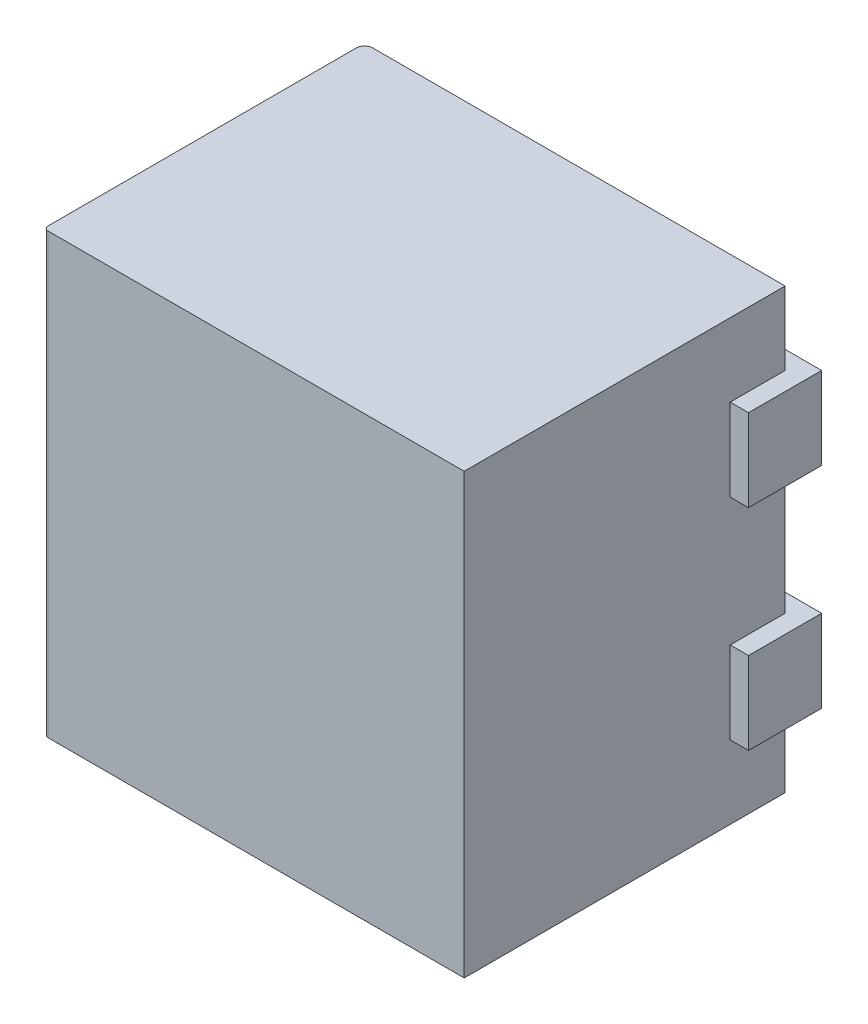
from build123d import *

# Parameters (mm, degrees)
SKETCH1_W           = 4.6
SKETCH1_H           = 4.8
BOSS_EXTRUDE1_DEPTH = 3.51
FILLET1_R           = 0.09
SKETCH2_W           = 1.14
SKETCH2_H           = 1.3
SKETCH2_W_2         = 1
SKETCH2_H_2         = 0.9
BOSS_EXTRUDE2_DEPTH = 0.8
FILLET2_R           = 0.15
SKETCH3_R           = 0.75
CUT_EXTRUDE1_DEPTH  = 0.5
FILLET3_R           = 0.05
SKETCH4_R           = 0.725
CUT_EXTRUDE2_DEPTH  = 0.01


with BuildPart() as part:
    # Sketch1 → Boss-Extrude1 (new body)
    with BuildSketch(Plane.XY):
        Rectangle(SKETCH1_W, SKETCH1_H)
    extrude(amount=BOSS_EXTRUDE1_DEPTH)

    # Fillet1
    fillet1_edges = [part.edges().sort_by_distance(p)[0] for p in [
        (-2.3, 0, 0),
    ]]
    fillet(fillet1_edges, radius=FILLET1_R)

    # Sketch2 → Boss-Extrude2 (add)
    with BuildSketch(Plane.XY.offset(-0.2)):
        with Locations((-1.93, 0)):
            Rectangle(SKETCH2_W, SKETCH2_H)
        with Locations((2, 1.15)):
            Rectangle(SKETCH2_W_2, SKETCH2_H_2)
        with Locations((2, -1.15)):
            Rectangle(SKETCH2_W_2, SKETCH2_H_2)
    extrude(amount=BOSS_EXTRUDE2_DEPTH)

    # Fillet2
    fillet2_edges = [part.edges().sort_by_distance(p)[0] for p in [
        (-2.5, 0, -0.2),
    ]]
    fillet(fillet2_edges, radius=FILLET2_R)

    # Sketch3 → Cut-Extrude1 (cut)
    with BuildSketch(Plane.ZY.offset(2.3)):
        with Locations((2.6, -1.2)):
            Circle(SKETCH3_R)
        with BuildLine():
            Line((1.921164098, -1.454571833), (2.854571833, -0.521164098))
            ThreePointArc((2.854571833, -0.521164098), (2.087347584, -0.687347584), (1.921164098, -1.454571833))
        make_face(mode=Mode.SUBTRACT)
        with BuildLine():
            Line((2.345428167, -1.878835902), (3.278835902, -0.945428167))
            ThreePointArc((3.278835902, -0.945428167), (3.112652416, -1.712652416), (2.345428167, -1.878835902))
        make_face(mode=Mode.SUBTRACT)
    extrude(amount=-CUT_EXTRUDE1_DEPTH, mode=Mode.SUBTRACT)

    # Fillet3
    fillet3_edges = [part.edges().sort_by_distance(p)[0] for p in [
        (-2.3, 0, 3.51),
    ]]
    fillet(fillet3_edges, radius=FILLET3_R)

    # Sketch4 → Cut-Extrude2 (cut)
    with BuildSketch(Plane.ZY.offset(2.3)):
        with Locations((2.6, -1.2)):
            Circle(SKETCH4_R)
    extrude(amount=-CUT_EXTRUDE2_DEPTH, mode=Mode.SUBTRACT)


solid = part.part
